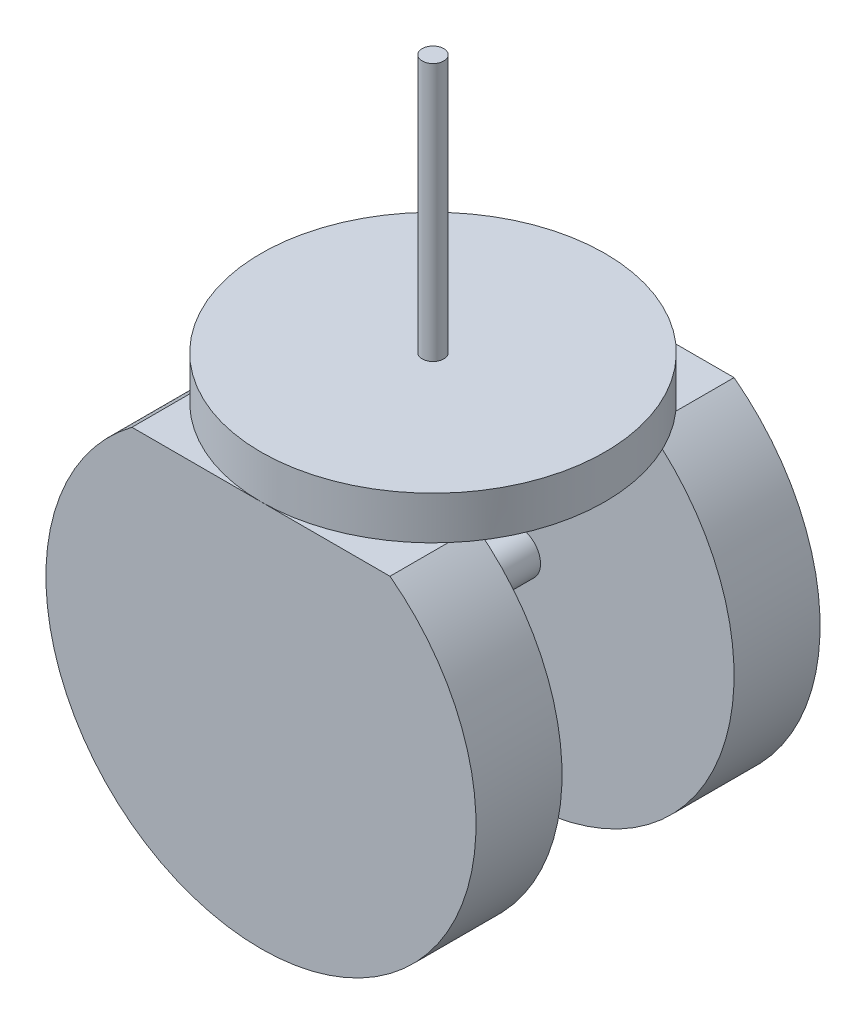
from build123d import *

# Parameters (mm, degrees)
SKETCH2_R           = 63.5
BOSS_EXTRUDE1_DEPTH = 25.4
SKETCH3_R           = 6.35
BOSS_EXTRUDE2_DEPTH = 50.8
BOSS_EXTRUDE3_START = 25.4
SKETCH4_R           = 63.5
BOSS_EXTRUDE3_DEPTH = 25.4
CUT_EXTRUDE1_START  = 76.2
SKETCH5_W           = 127
SKETCH5_H           = 101.6
CUT_EXTRUDE1_DEPTH  = 25.4
SKETCH6_R           = 50.8
BOSS_EXTRUDE4_DEPTH = 12.7
SKETCH7_R           = 3.175
BOSS_EXTRUDE5_DEPTH = 76.2


with BuildPart() as part:
    # Sketch2 → Boss-Extrude1 (new body)
    with BuildSketch(Plane.XY):
        Circle(SKETCH2_R)
    extrude(amount=BOSS_EXTRUDE1_DEPTH)

    # Sketch3 → Boss-Extrude2 (add)
    with BuildSketch(Plane(origin=(0, 0, 0), x_dir=(-1, 0, 0), z_dir=(0, 0, -1))):
        with Locations(Location((0, 0, 0), (0, 0, 180))):
            Circle(SKETCH3_R)
    extrude(amount=BOSS_EXTRUDE2_DEPTH)

    # Sketch4 → Boss-Extrude3 (add)
    with BuildSketch(Plane(origin=(0, 0, -50.8), x_dir=(-1, 0, 0), z_dir=(0, 0, -1)).offset(BOSS_EXTRUDE3_START)):
        with Locations(Location((0, 0, 0), (0, 0, 180))):
            Circle(SKETCH4_R)
    extrude(amount=-BOSS_EXTRUDE3_DEPTH)

    # Sketch5 → Cut-Extrude1 (cut)
    with BuildSketch(Plane(origin=(0, 0, 0), x_dir=(1, 0, 0), z_dir=(0, 1, 0)).offset(CUT_EXTRUDE1_START)):
        with Locations((0, 25.4)):
            Rectangle(SKETCH5_W, SKETCH5_H)
    extrude(amount=-CUT_EXTRUDE1_DEPTH, mode=Mode.SUBTRACT)

    # Sketch6 → Boss-Extrude4 (add)
    with BuildSketch(Plane(origin=(0, 50.8, 0), x_dir=(1, 0, 0), z_dir=(0, 1, 0))):
        with Locations(Location((0, 25.4, 0), (0, 0, 270))):
            Circle(SKETCH6_R)
    extrude(amount=BOSS_EXTRUDE4_DEPTH)

    # Sketch7 → Boss-Extrude5 (add)
    with BuildSketch(Plane(origin=(0, 63.5, 0), x_dir=(1, 0, 0), z_dir=(0, 1, 0))):
        with Locations(Location((0, 25.4, 0), (0, 0, 90))):
            Circle(SKETCH7_R)
    extrude(amount=BOSS_EXTRUDE5_DEPTH)


solid = part.part
